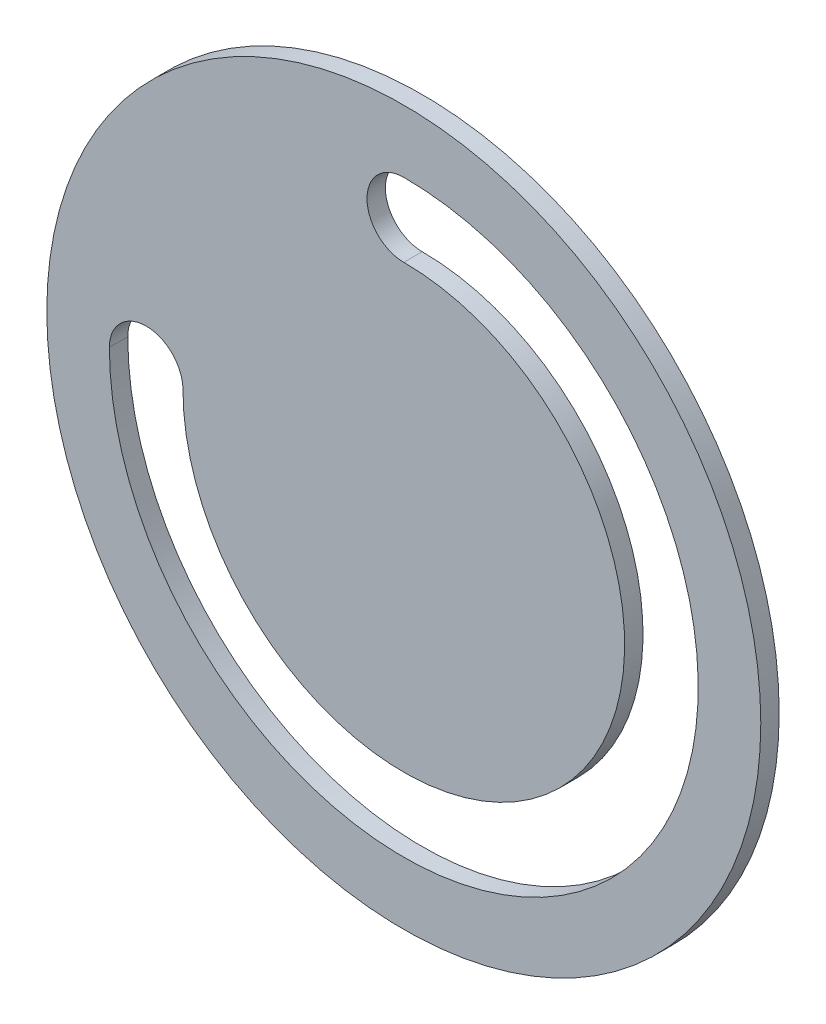
from build123d import *

# Parameters (mm, degrees)
SKETCH_1_R          = 9.7
EXTRUDE_1_DEPTH     = 0.5
CUT_EXTRUDE_1_DEPTH = 14.726980731


with BuildPart() as part:
    # 草图1 → 凸台-拉伸1 (new body)
    with BuildSketch(Plane.XY):
        Circle(SKETCH_1_R)
    extrude(amount=EXTRUDE_1_DEPTH)

    # 草图3 → 切除-拉伸1 (cut, through all)
    with BuildSketch(Plane.XY.offset(0.5)):
        with BuildLine():
            ThreePointArc((-8, 0), (5.656854249, -5.656854249), (0, 8))
            ThreePointArc((0, 8), (-1, 7), (0, 6))
            ThreePointArc((0, 6), (4.242640687, -4.242640687), (-6, 0))
            ThreePointArc((-6, 0), (-7, 1), (-8, 0))
        make_face()
    extrude(amount=-CUT_EXTRUDE_1_DEPTH, mode=Mode.SUBTRACT)


solid = part.part
